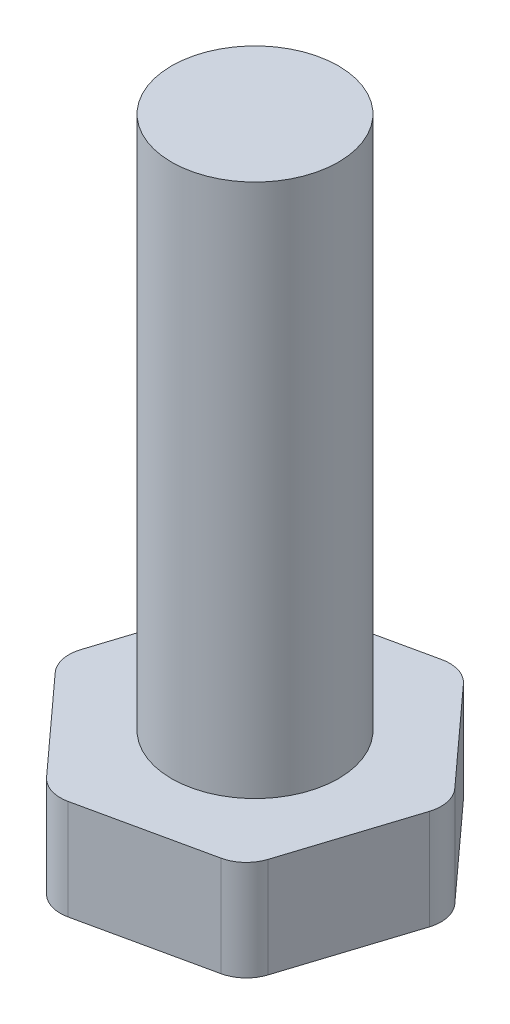
from build123d import *

# Parameters (mm, degrees)
EXTRUDE_1_DEPTH = 3
SKETCH_4_R      = 2.5
EXTRUDE_2_DEPTH = 16
FILLET_1_R      = 1


with BuildPart() as part:
    # 草图2 → 凸台-拉伸1 (new body)
    with BuildSketch(Plane(origin=(0, 0, 0), x_dir=(1, 0, 0), z_dir=(0, 1, 0))):
        Polygon((7.324934491, 4.171243509), (8.84728701, 8.933852332), (5.48392304, 12.633552699), (0.598206551, 11.570644242), (-0.924145968, 6.808035419), (2.439218002, 3.108335052), align=None)
    extrude(amount=EXTRUDE_1_DEPTH)

    # 草图4 → 凸台-拉伸2 (add)
    with BuildSketch(Plane(origin=(0, 3, 0), x_dir=(1, 0, 0), z_dir=(0, 1, 0))):
        with Locations(Location((3.961570521, 7.870943875, 0), (0, 0, 270))):
            Circle(SKETCH_4_R)
    extrude(amount=EXTRUDE_2_DEPTH)

    # 圆角1
    fillet_1_edges = [part.edges().sort_by_distance(p)[0] for p in [
        (8.84728701, 1.5, -8.933852332),
        (7.324934491, 1.5, -4.171243509),
        (2.439218002, 1.5, -3.108335052),
        (-0.924145968, 1.5, -6.808035419),
        (0.598206551, 1.5, -11.570644242),
        (5.48392304, 1.5, -12.633552699),
    ]]
    fillet(fillet_1_edges, radius=FILLET_1_R)


solid = part.part
